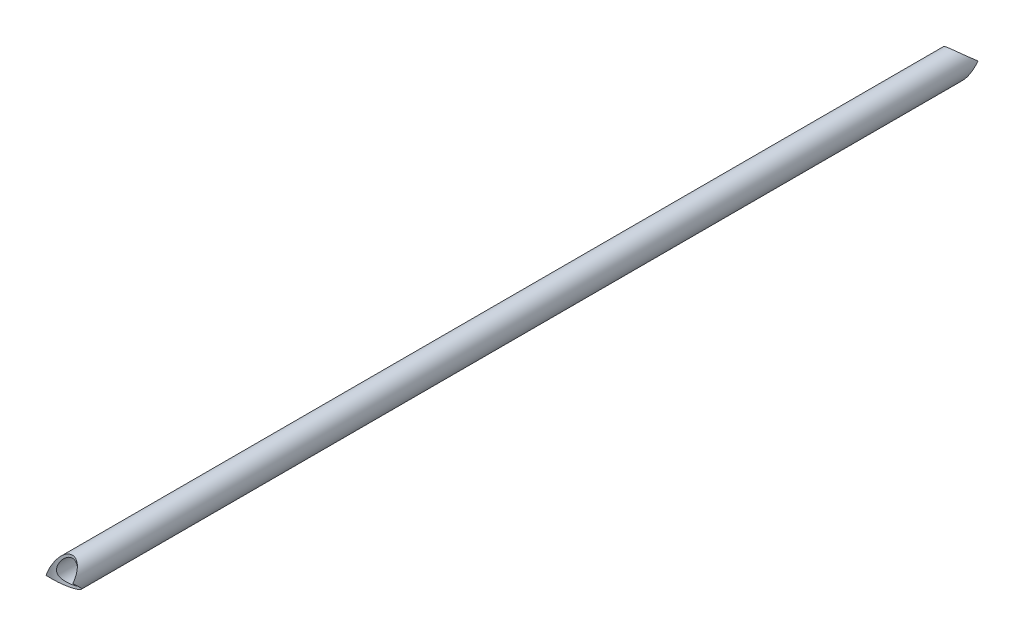
from build123d import *

# Parameters (mm, degrees)
SKETCH1_R                          = 7.9375
SKETCH1_R_2                        = 6.437500000000001
PIPE_CONFIGURED_21_3_X_2_3_3_DEPTH = 522.055690959
ESBO_O11_R                         = 7.937500000000085
ESBO_O12_R                         = 7.937500000000085


with BuildPart() as part:
    # Sketch1 → Pipe - configured 21.3 X 2.3(3) (new body)
    with BuildSketch(Plane(origin=(854.3898367144717, 250, -261.0278454796051), x_dir=(1, 0, 0), z_dir=(0, 0, 1))):
        Circle(SKETCH1_R)
        Circle(SKETCH1_R_2, mode=Mode.SUBTRACT)
    extrude(amount=PIPE_CONFIGURED_21_3_X_2_3_3_DEPTH)

    # Varredura de corte1: sweep along a curve in space
    with BuildLine() as varredura_de_corte1_path:
        Line((910.0000000000001, 0, 265), (910.0000000000001, 139.26905749604418, 265))
        ThreePointArc((910.0000000000001, 139.26905749604418, 265), (908.6404967596997, 149.62181930014503, 264.9028926256928), (904.6546349379392, 159.26905749604424, 264.61818820985286))
        Line((904.6546349379392, 159.26905749604424, 264.61818820985286), (858.6941735437408, 239.0777295619333, 261.3352981102673))
        ThreePointArc((858.6941735437408, 239.0777295619333, 261.3352981102673), (854.2945586384378, 250.42014500440925, 261.02103990274554), (853.500633741435, 262.56395927183974, 260.964330981531))
        Line((853.500633741435, 262.56395927183974, 260.964330981531), (910.0000000000001, 910, 265))
    # Esboço11 → Varredura de corte1 (sweep, cut)
    with BuildSketch(Plane(origin=(0, 0, 0), x_dir=(1, 0, 0), z_dir=(0, 1, 0))):
        with Locations((910.0000000000001, -265)):
            Circle(ESBO_O11_R)
    sweep(path=varredura_de_corte1_path.line, mode=Mode.SUBTRACT)

    # Varredura de corte2: sweep along a curve in space
    with BuildLine() as varredura_de_corte2_path:
        Line((910.0000000000001, 0, -265), (910.0000000000001, 139.26905749604356, -265))
        ThreePointArc((910.0000000000001, 139.26905749604356, -265), (908.6404967596995, 149.62181930014447, -264.9028926256928), (904.6546349379391, 159.26905749604364, -264.6181882098528))
        Line((904.6546349379391, 159.26905749604364, -264.6181882098528), (858.6941735437406, 239.07772956193315, -261.33529811026716))
        ThreePointArc((858.6941735437406, 239.07772956193315, -261.33529811026716), (854.2945586384376, 250.4201450044091, -261.0210399027455), (853.5006337414345, 262.5639592718396, -260.96433098153096))
        Line((853.5006337414345, 262.5639592718396, -260.96433098153096), (910.0000000000001, 910, -265))
    # Esboço12 → Varredura de corte2 (sweep, cut)
    with BuildSketch(Plane(origin=(0, 0, 0), x_dir=(1, 0, 0), z_dir=(0, 1, 0))):
        with Locations((910.0000000000001, 265)):
            Circle(ESBO_O12_R)
    sweep(path=varredura_de_corte2_path.line, mode=Mode.SUBTRACT)


solid = part.part
